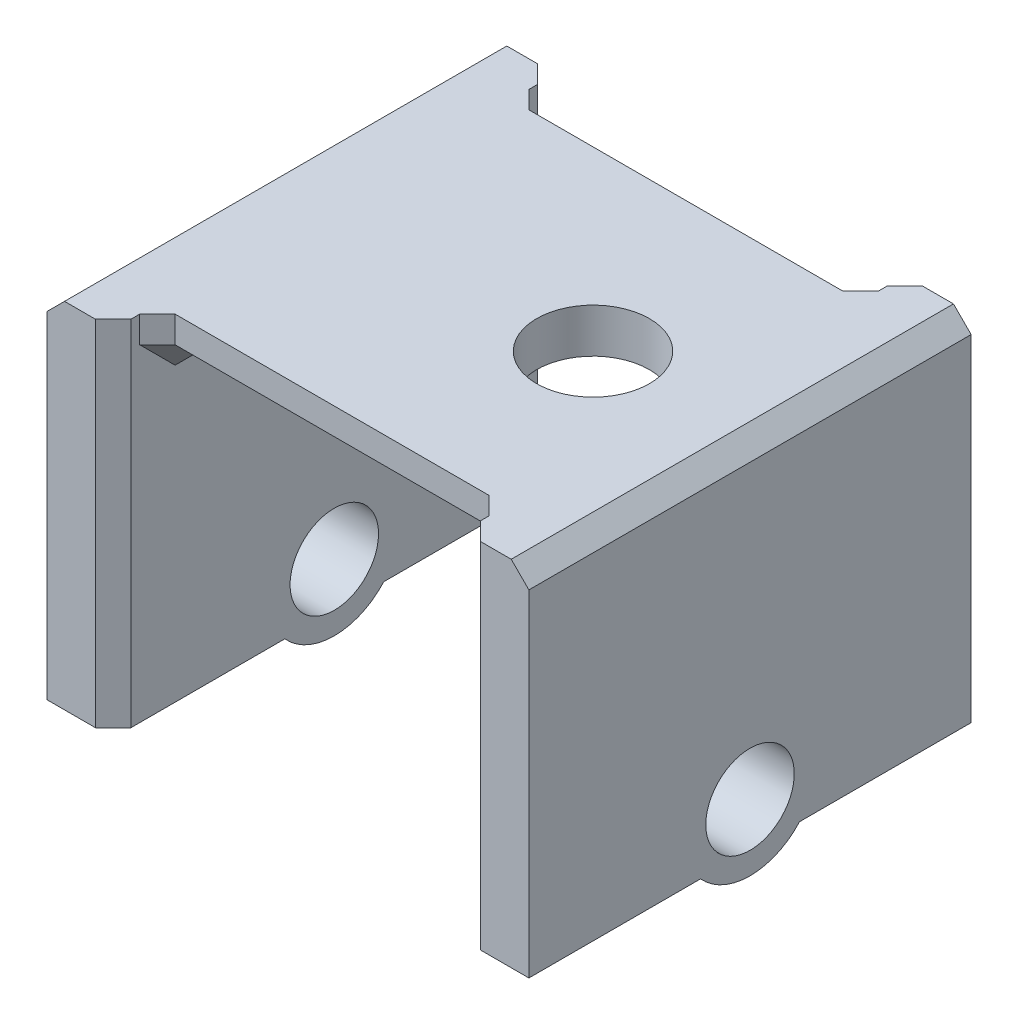
from build123d import *

# Parameters (mm, degrees)
BOSS_EXTRUDE1_DEPTH            = 50
CUT_EXTRUDE1_DEPTH             = 67.839827199
CUT_EXTRUDE1_DEPTH_BACK        = 67.839827199
SKETCH3_W                      = 39.5
SKETCH3_H                      = 5
CHAMFER1_SIZE                  = 2
BOSS_EXTRUDE2_DEPTH            = 7.5
CUT_EXTRUDE4_REACH             = 86.085
SKETCH5_R                      = 5
CUT_EXTRUDE4_DIRECTION_2_DEPTH = 85.084778646
SKETCH6_R                      = 6.375
CUT_EXTRUDE5_DEPTH             = 69.182200757


with BuildPart() as part:
    # Sketch1 → Boss-Extrude1 (new body)
    with BuildSketch(Plane.XY):
        Polygon((-27.25, 0), (-19.75, 0), (-19.75, 35), (19.75, 35), (19.75, 0), (27.25, 0), (27.25, 40), (-27.25, 40), align=None)
    extrude(amount=BOSS_EXTRUDE1_DEPTH)

    # Sketch3 → Cut-Extrude1 (cut, two sides: drawn at the far end of the back side and taken through both)
    with BuildSketch(Plane(origin=(0, 35, 0), x_dir=(-1, 0, 0), z_dir=(0, -1, 0)).offset(-CUT_EXTRUDE1_DEPTH_BACK)):
        with Locations((0, -2.5)):
            Rectangle(SKETCH3_W, SKETCH3_H)
        with Locations((0, -47.5)):
            Rectangle(SKETCH3_W, SKETCH3_H)
    extrude(amount=CUT_EXTRUDE1_DEPTH + CUT_EXTRUDE1_DEPTH_BACK, mode=Mode.SUBTRACT)

    # Chamfer1
    chamfer1_edges = [part.edges().sort_by_distance(p)[0] for p in [
        (-19.75, 20, 0),
        (-19.75, 20, 50),
        (-27.25, 40, 25),
        (27.25, 40, 25),
        (19.75, 20, 50),
        (19.75, 35, 25),
        (-19.75, 35, 25),
        (-19.75, 37.5, 5),
        (0, 35, 5),
        (19.75, 37.5, 5),
        (19.75, 37.5, 45),
        (0, 35, 45),
        (-19.75, 37.5, 45),
        (19.75, 20, 0),
    ]]
    chamfer(chamfer1_edges, length=CHAMFER1_SIZE)

    # Sketch4 → Boss-Extrude2 (add)
    with BuildSketch(Plane.ZY.offset(27.25)):
        with BuildLine():
            Line((30.590169944, 0), (19.409830056, 0))
            ThreePointArc((19.409830056, 0), (25, -2.5), (30.590169944, 0))
        make_face()
    boss_extrude2 = extrude(amount=-BOSS_EXTRUDE2_DEPTH)

    # Sketch5 → Cut-Extrude4 (cut, up to next)
    with BuildSketch(Plane.ZY.offset(27.25), mode=Mode.PRIVATE) as cut_extrude4_sk1:
        with Locations(Location((25, 5, 0), (0, 0, 180))):
            Circle(SKETCH5_R)
    cut_extrude4_tool1 = extrude(cut_extrude4_sk1.sketch, amount=-CUT_EXTRUDE4_REACH, mode=Mode.PRIVATE) & part.part
    cut_extrude4 = cut_extrude4_tool1.solids().sort_by_distance((-27.25, 5, 25))[0]
    add(cut_extrude4, mode=Mode.SUBTRACT)

    # Sketch5 → Cut-Extrude4 direction 2 (cut)
    with BuildSketch(Plane.ZY.offset(27.25)):
        with Locations(Location((25, 5, 0), (0, 0, 180))):
            Circle(SKETCH5_R)
    cut_extrude4_direction_2 = extrude(amount=CUT_EXTRUDE4_DIRECTION_2_DEPTH, mode=Mode.SUBTRACT)

    # Mirror1: Boss-Extrude2, Cut-Extrude4, Cut-Extrude4 direction 2 across plane
    add(boss_extrude2.mirror(Plane(origin=(0, 0, 0), x_dir=(0, 0, 1), z_dir=(1, 0, 0))))
    add(cut_extrude4.mirror(Plane(origin=(0, 0, 0), x_dir=(0, 0, 1), z_dir=(1, 0, 0))), mode=Mode.SUBTRACT)
    add(cut_extrude4_direction_2.mirror(Plane(origin=(0, 0, 0), x_dir=(0, 0, 1), z_dir=(1, 0, 0))), mode=Mode.SUBTRACT)

    # Sketch6 → Cut-Extrude5 (cut, through all)
    with BuildSketch(Plane.XZ.offset(-35)):
        with Locations(Location((9.5, 25, 0), (0, 0, 270))):
            Circle(SKETCH6_R)
    extrude(amount=-CUT_EXTRUDE5_DEPTH, mode=Mode.SUBTRACT)


solid = part.part
